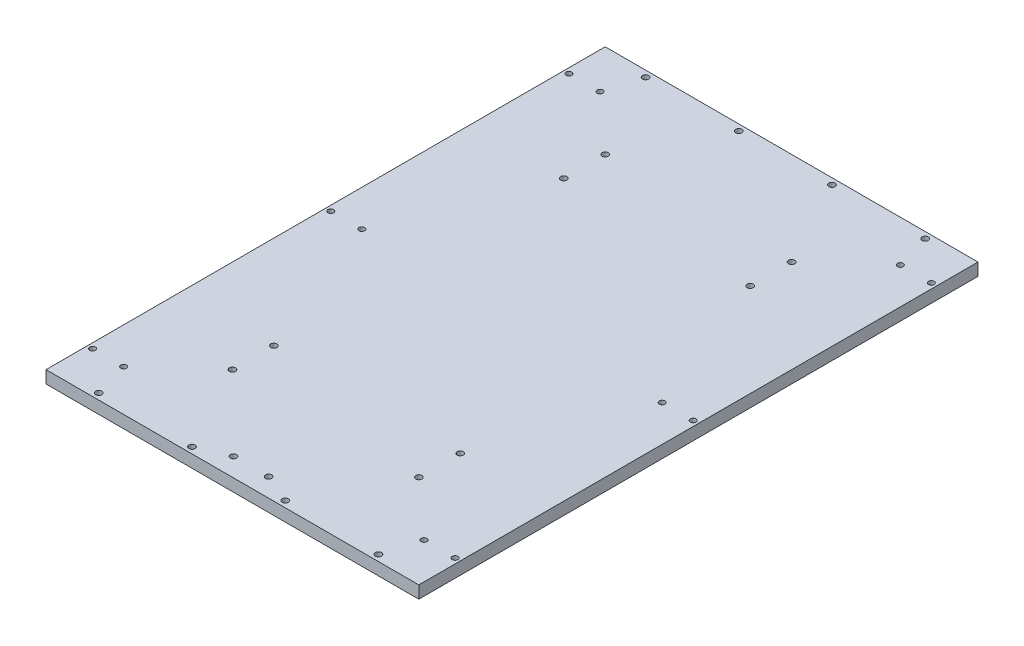
from build123d import *

# Parameters (mm, degrees)
SKETCH1_W               = 360
SKETCH1_H               = 540
BOSS_EXTRUDE1_DEPTH     = 12
CUT_EXTRUDE1_REACH      = 326.721
SKETCH2_R               = 3
CUT_EXTRUDE2_REACH      = 326.721
SKETCH3_R               = 3
LPATTERN1_COUNT         = 4
LPATTERN1_PITCH         = 90
MIRROR1_COPY_1_REACH    = 326.721
MIRROR1_COPY_1_SKETCH_R = 3
MIRROR1_COPY_2_REACH    = 326.721
MIRROR1_COPY_2_SKETCH_R = 3
MIRROR1_COPY_3_REACH    = 326.721
MIRROR1_COPY_3_SKETCH_R = 3
CUT_EXTRUDE3_REACH      = 326.721
SKETCH4_R               = 2.75
LPATTERN2_COUNT         = 3
LPATTERN2_PITCH         = 230
MIRROR2_COPY_1_REACH    = 326.721
MIRROR2_COPY_1_SKETCH_R = 2.75
MIRROR2_COPY_2_REACH    = 326.721
MIRROR2_COPY_2_SKETCH_R = 2.75
CUT_EXTRUDE4_REACH      = 326.721
SKETCH6_R               = 3
MIRROR4_COPY_1_REACH    = 326.721
MIRROR4_COPY_1_SKETCH_R = 3


with BuildPart() as part:
    # Sketch1 → Boss-Extrude1 (new body)
    with BuildSketch(Plane(origin=(0, 0, 0), x_dir=(1, 0, 0), z_dir=(0, 1, 0))):
        Rectangle(SKETCH1_W, SKETCH1_H)
    extrude(amount=BOSS_EXTRUDE1_DEPTH)

    # Sketch2 → Cut-Extrude1 (cut, up to next)
    with BuildSketch(Plane.XZ, mode=Mode.PRIVATE) as cut_extrude1_sk1:
        with Locations(Location((-17, 252, 0), (0, 0, 270))):
            Circle(SKETCH2_R)
    cut_extrude1_tool1 = extrude(cut_extrude1_sk1.sketch, amount=-CUT_EXTRUDE1_REACH, mode=Mode.PRIVATE) & part.part
    # Sketch2 → Cut-Extrude1 (cut, up to next)
    with BuildSketch(Plane.XZ, mode=Mode.PRIVATE) as cut_extrude1_sk2:
        with Locations(Location((17, 252, 0), (0, 0, 270))):
            Circle(SKETCH2_R)
    cut_extrude1_tool2 = extrude(cut_extrude1_sk2.sketch, amount=-CUT_EXTRUDE1_REACH, mode=Mode.PRIVATE) & part.part
    add(cut_extrude1_tool1.solids().sort_by_distance((-17, 0, 252))[0], mode=Mode.SUBTRACT)
    add(cut_extrude1_tool2.solids().sort_by_distance((17, 0, 252))[0], mode=Mode.SUBTRACT)

    # Sketch3 → Cut-Extrude2 (cut, up to next)
    with BuildSketch(Plane.XZ, mode=Mode.PRIVATE) as cut_extrude2_sk1:
        with Locations(Location((135, 264, 0), (0, 0, 270))):
            Circle(SKETCH3_R)
    cut_extrude2_tool1 = extrude(cut_extrude2_sk1.sketch, amount=-CUT_EXTRUDE2_REACH, mode=Mode.PRIVATE) & part.part
    cut_extrude2 = cut_extrude2_tool1.solids().sort_by_distance((135, 0, 264))[0]
    add(cut_extrude2, mode=Mode.SUBTRACT)

    # LPattern1: Cut-Extrude2 ×4
    with Locations(*[(-i * LPATTERN1_PITCH, 0, 0) for i in range(1, LPATTERN1_COUNT)]):
        add(cut_extrude2, mode=Mode.SUBTRACT)

    # Mirror1: Cut-Extrude2 across plane
    add(cut_extrude2.mirror(Plane.XY), mode=Mode.SUBTRACT)

    # Mirror1 copy 1 sketch → Mirror1 copy 1 (cut, up to next)
    with BuildSketch(Plane(origin=(-90, 0, 0), x_dir=(1, 0, 0), z_dir=(0, -1, 0)), mode=Mode.PRIVATE) as mirror1_copy_1_sk1:
        with Locations((135, -264)):
            Circle(MIRROR1_COPY_1_SKETCH_R)
    mirror1_copy_1_tool1 = extrude(mirror1_copy_1_sk1.sketch, amount=-MIRROR1_COPY_1_REACH, mode=Mode.PRIVATE) & part.part
    add(mirror1_copy_1_tool1.solids().sort_by_distance((45, 0, -264))[0], mode=Mode.SUBTRACT)

    # Mirror1 copy 2 sketch → Mirror1 copy 2 (cut, up to next)
    with BuildSketch(Plane(origin=(-180, 0, 0), x_dir=(1, 0, 0), z_dir=(0, -1, 0)), mode=Mode.PRIVATE) as mirror1_copy_2_sk1:
        with Locations((135, -264)):
            Circle(MIRROR1_COPY_2_SKETCH_R)
    mirror1_copy_2_tool1 = extrude(mirror1_copy_2_sk1.sketch, amount=-MIRROR1_COPY_2_REACH, mode=Mode.PRIVATE) & part.part
    add(mirror1_copy_2_tool1.solids().sort_by_distance((-45, 0, -264))[0], mode=Mode.SUBTRACT)

    # Mirror1 copy 3 sketch → Mirror1 copy 3 (cut, up to next)
    with BuildSketch(Plane(origin=(-270, 0, 0), x_dir=(1, 0, 0), z_dir=(0, -1, 0)), mode=Mode.PRIVATE) as mirror1_copy_3_sk1:
        with Locations((135, -264)):
            Circle(MIRROR1_COPY_3_SKETCH_R)
    mirror1_copy_3_tool1 = extrude(mirror1_copy_3_sk1.sketch, amount=-MIRROR1_COPY_3_REACH, mode=Mode.PRIVATE) & part.part
    add(mirror1_copy_3_tool1.solids().sort_by_distance((-135, 0, -264))[0], mode=Mode.SUBTRACT)

    # Sketch4 → Cut-Extrude3 (cut, up to next)
    with BuildSketch(Plane(origin=(0, 12, 0), x_dir=(1, 0, 0), z_dir=(0, 1, 0)), mode=Mode.PRIVATE) as cut_extrude3_sk1:
        with Locations(Location((-175, 230, 0), (0, 0, 270))):
            Circle(SKETCH4_R)
    cut_extrude3_tool1 = extrude(cut_extrude3_sk1.sketch, amount=-CUT_EXTRUDE3_REACH, mode=Mode.PRIVATE) & part.part
    # Sketch4 → Cut-Extrude3 (cut, up to next)
    with BuildSketch(Plane(origin=(0, 12, 0), x_dir=(1, 0, 0), z_dir=(0, 1, 0)), mode=Mode.PRIVATE) as cut_extrude3_sk2:
        with Locations(Location((-145, 230, 0), (0, 0, 270))):
            Circle(SKETCH4_R)
    cut_extrude3_tool2 = extrude(cut_extrude3_sk2.sketch, amount=-CUT_EXTRUDE3_REACH, mode=Mode.PRIVATE) & part.part
    cut_extrude3_1 = cut_extrude3_tool1.solids().sort_by_distance((-175, 12, -230))[0]
    add(cut_extrude3_1, mode=Mode.SUBTRACT)
    cut_extrude3_2 = cut_extrude3_tool2.solids().sort_by_distance((-145, 12, -230))[0]
    add(cut_extrude3_2, mode=Mode.SUBTRACT)
    cut_extrude3 = cut_extrude3_1 + cut_extrude3_2  # Cut-Extrude3 as one shape, for the pattern or mirror that repeats it

    # LPattern2: Cut-Extrude3 ×3
    with Locations(*[(0, 0, i * LPATTERN2_PITCH) for i in range(1, LPATTERN2_COUNT)]):
        add(cut_extrude3, mode=Mode.SUBTRACT)

    # Mirror2: Cut-Extrude3 across plane
    add(cut_extrude3.mirror(Plane(origin=(0, 0, 0), x_dir=(0, 0, 1), z_dir=(1, 0, 0))), mode=Mode.SUBTRACT)

    # Mirror2 copy 1 sketch → Mirror2 copy 1 (cut, up to next)
    with BuildSketch(Plane(origin=(0, 12, 230), x_dir=(-1, 0, 0), z_dir=(0, 1, 0)), mode=Mode.PRIVATE) as mirror2_copy_1_sk1:
        with Locations((-175, -230)):
            Circle(MIRROR2_COPY_1_SKETCH_R)
    mirror2_copy_1_tool1 = extrude(mirror2_copy_1_sk1.sketch, amount=-MIRROR2_COPY_1_REACH, mode=Mode.PRIVATE) & part.part
    # Mirror2 copy 1 sketch → Mirror2 copy 1 (cut, up to next)
    with BuildSketch(Plane(origin=(0, 12, 230), x_dir=(-1, 0, 0), z_dir=(0, 1, 0)), mode=Mode.PRIVATE) as mirror2_copy_1_sk2:
        with Locations((-145, -230)):
            Circle(MIRROR2_COPY_1_SKETCH_R)
    mirror2_copy_1_tool2 = extrude(mirror2_copy_1_sk2.sketch, amount=-MIRROR2_COPY_1_REACH, mode=Mode.PRIVATE) & part.part
    add(mirror2_copy_1_tool1.solids().sort_by_distance((175, 12, 0))[0], mode=Mode.SUBTRACT)
    add(mirror2_copy_1_tool2.solids().sort_by_distance((145, 12, 0))[0], mode=Mode.SUBTRACT)

    # Mirror2 copy 2 sketch → Mirror2 copy 2 (cut, up to next)
    with BuildSketch(Plane(origin=(0, 12, 460), x_dir=(-1, 0, 0), z_dir=(0, 1, 0)), mode=Mode.PRIVATE) as mirror2_copy_2_sk1:
        with Locations((-175, -230)):
            Circle(MIRROR2_COPY_2_SKETCH_R)
    mirror2_copy_2_tool1 = extrude(mirror2_copy_2_sk1.sketch, amount=-MIRROR2_COPY_2_REACH, mode=Mode.PRIVATE) & part.part
    # Mirror2 copy 2 sketch → Mirror2 copy 2 (cut, up to next)
    with BuildSketch(Plane(origin=(0, 12, 460), x_dir=(-1, 0, 0), z_dir=(0, 1, 0)), mode=Mode.PRIVATE) as mirror2_copy_2_sk2:
        with Locations((-145, -230)):
            Circle(MIRROR2_COPY_2_SKETCH_R)
    mirror2_copy_2_tool2 = extrude(mirror2_copy_2_sk2.sketch, amount=-MIRROR2_COPY_2_REACH, mode=Mode.PRIVATE) & part.part
    add(mirror2_copy_2_tool1.solids().sort_by_distance((175, 12, 230))[0], mode=Mode.SUBTRACT)
    add(mirror2_copy_2_tool2.solids().sort_by_distance((145, 12, 230))[0], mode=Mode.SUBTRACT)

    # Sketch6 → Cut-Extrude4 (cut, up to next)
    with BuildSketch(Plane(origin=(0, 12, 0), x_dir=(1, 0, 0), z_dir=(0, 1, 0)), mode=Mode.PRIVATE) as cut_extrude4_sk1:
        with Locations(Location((-90, 180, 0), (0, 0, 270))):
            Circle(SKETCH6_R)
    cut_extrude4_tool1 = extrude(cut_extrude4_sk1.sketch, amount=-CUT_EXTRUDE4_REACH, mode=Mode.PRIVATE) & part.part
    # Sketch6 → Cut-Extrude4 (cut, up to next)
    with BuildSketch(Plane(origin=(0, 12, 0), x_dir=(1, 0, 0), z_dir=(0, 1, 0)), mode=Mode.PRIVATE) as cut_extrude4_sk2:
        with Locations(Location((-90, 140, 0), (0, 0, 270))):
            Circle(SKETCH6_R)
    cut_extrude4_tool2 = extrude(cut_extrude4_sk2.sketch, amount=-CUT_EXTRUDE4_REACH, mode=Mode.PRIVATE) & part.part
    cut_extrude4_1 = cut_extrude4_tool1.solids().sort_by_distance((-90, 12, -180))[0]
    add(cut_extrude4_1, mode=Mode.SUBTRACT)
    cut_extrude4_2 = cut_extrude4_tool2.solids().sort_by_distance((-90, 12, -140))[0]
    add(cut_extrude4_2, mode=Mode.SUBTRACT)
    cut_extrude4 = cut_extrude4_1 + cut_extrude4_2  # Cut-Extrude4 as one shape, for the pattern or mirror that repeats it

    # Mirror3: Cut-Extrude4 across plane
    add(cut_extrude4.mirror(Plane.XY), mode=Mode.SUBTRACT)

    # Mirror4: Cut-Extrude4 across plane
    add(cut_extrude4.mirror(Plane(origin=(0, 0, 0), x_dir=(0, 0, 1), z_dir=(1, 0, 0))), mode=Mode.SUBTRACT)

    # Mirror4 copy 1 sketch → Mirror4 copy 1 (cut, up to next)
    with BuildSketch(Plane(origin=(0, 12, 0), x_dir=(-1, 0, 0), z_dir=(0, 1, 0)), mode=Mode.PRIVATE) as mirror4_copy_1_sk1:
        with Locations(Location((-90, 180, 0), (0, 0, 270))):
            Circle(MIRROR4_COPY_1_SKETCH_R)
    mirror4_copy_1_tool1 = extrude(mirror4_copy_1_sk1.sketch, amount=-MIRROR4_COPY_1_REACH, mode=Mode.PRIVATE) & part.part
    # Mirror4 copy 1 sketch → Mirror4 copy 1 (cut, up to next)
    with BuildSketch(Plane(origin=(0, 12, 0), x_dir=(-1, 0, 0), z_dir=(0, 1, 0)), mode=Mode.PRIVATE) as mirror4_copy_1_sk2:
        with Locations(Location((-90, 140, 0), (0, 0, 270))):
            Circle(MIRROR4_COPY_1_SKETCH_R)
    mirror4_copy_1_tool2 = extrude(mirror4_copy_1_sk2.sketch, amount=-MIRROR4_COPY_1_REACH, mode=Mode.PRIVATE) & part.part
    add(mirror4_copy_1_tool1.solids().sort_by_distance((90, 12, 180))[0], mode=Mode.SUBTRACT)
    add(mirror4_copy_1_tool2.solids().sort_by_distance((90, 12, 140))[0], mode=Mode.SUBTRACT)


solid = part.part
